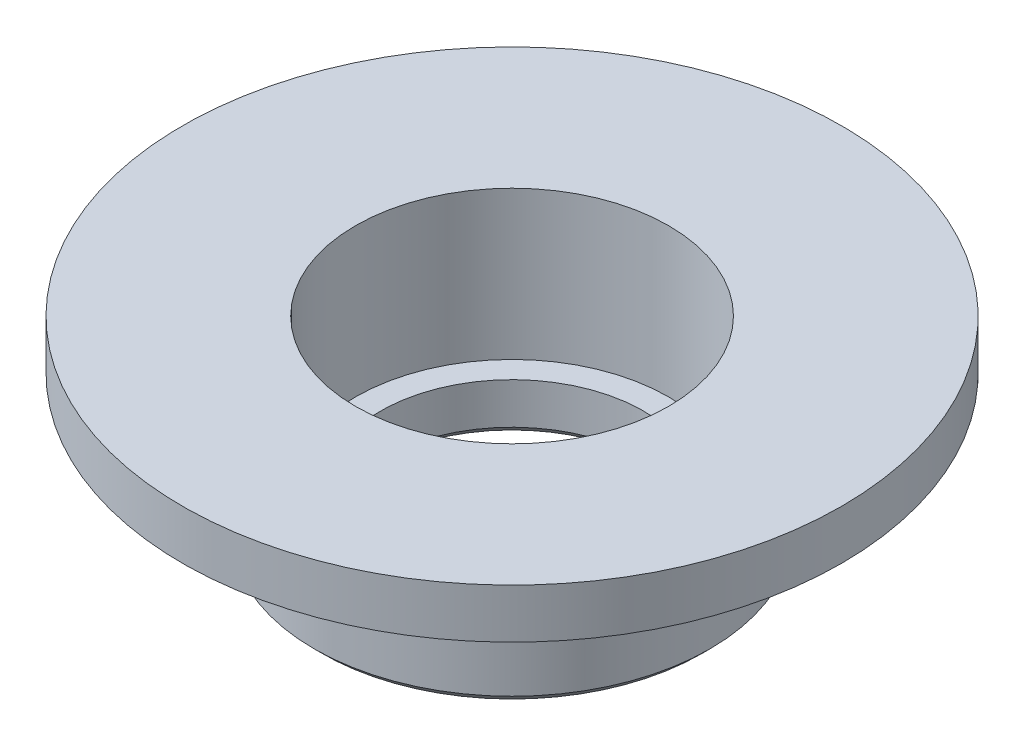
from build123d import *

# Parameters (mm, degrees)
SMUSSO1_SIZE = 0.5


with BuildPart() as part:
    # Schizzo1 → Rivoluzione1 (revolve)
    with BuildSketch(Plane.XY):
        Polygon((9.5, 0), (20, 0), (20, -3), (12, -3), (12, -12), (8, -12), (8, -9), (9.5, -9), align=None)
    revolve(axis=Axis((0, -37.45263556, 0), (0, 1, 0)))

    # Smusso1
    smusso1_edges = [part.edges().sort_by_distance(p)[0] for p in [
        (-8, -12, 0),
        (-12, -12, 0),
    ]]
    chamfer(smusso1_edges, length=SMUSSO1_SIZE)


solid = part.part
